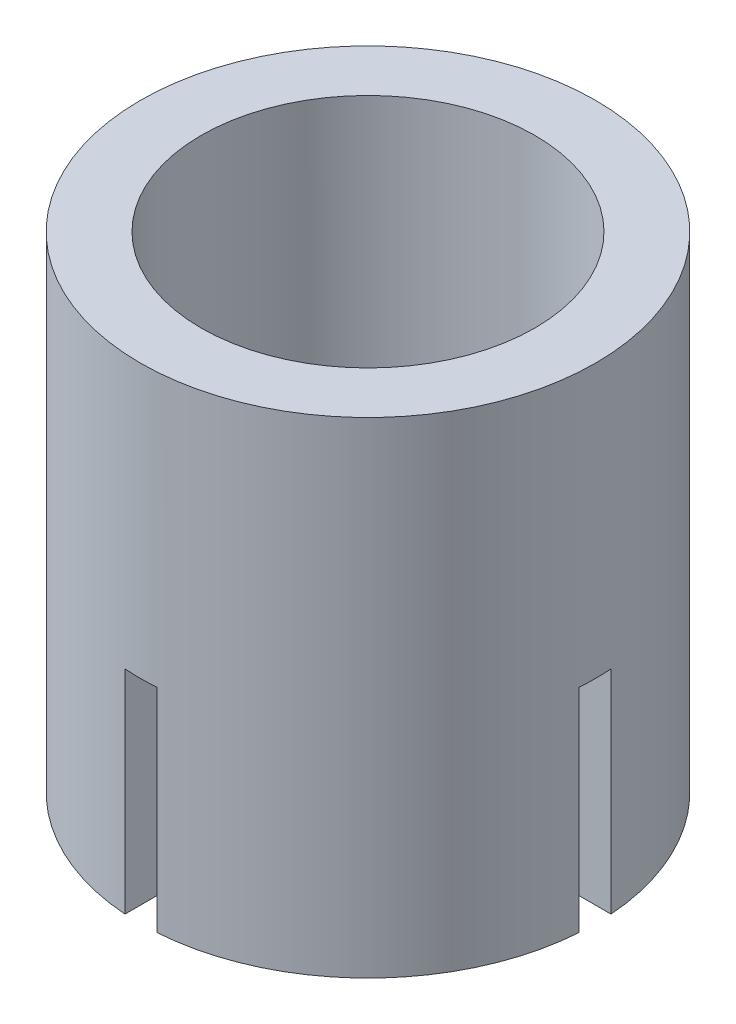
from build123d import *

# Parameters (mm, degrees)
SKETCH1_R           = 7.5
SKETCH1_R_2         = 3
BOSS_EXTRUDE1_DEPTH = 6
SKETCH2_R           = 7.5
SKETCH2_R_2         = 5.5
BOSS_EXTRUDE2_DEPTH = 10
CUT_EXTRUDE1_DEPTH  = 7


with BuildPart() as part:
    # Sketch1 → Boss-Extrude1 (new body)
    with BuildSketch(Plane(origin=(0, 0, 0), x_dir=(1, 0, 0), z_dir=(0, 1, 0))):
        with Locations(Location((0, 0, 0), (0, 0, 270))):
            Circle(SKETCH1_R)
        with Locations(Location((0, 0, 0), (0, 0, 270))):
            Circle(SKETCH1_R_2, mode=Mode.SUBTRACT)
    extrude(amount=BOSS_EXTRUDE1_DEPTH)

    # Sketch2 → Boss-Extrude2 (add)
    with BuildSketch(Plane(origin=(0, 6, 0), x_dir=(1, 0, 0), z_dir=(0, 1, 0))):
        with Locations(Location((0, 0, 0), (0, 0, 270))):
            Circle(SKETCH2_R)
        with Locations(Location((0, 0, 0), (0, 0, 270))):
            Circle(SKETCH2_R_2, mode=Mode.SUBTRACT)
    extrude(amount=BOSS_EXTRUDE2_DEPTH)

    # Sketch3 → Cut-Extrude1 (cut)
    with BuildSketch(Plane.XZ):
        with BuildLine():
            Line((-0.527362107, 10.532593193), (-0.527362107, 7.481436306))
            ThreePointArc((-0.527362107, 7.481436306), (0, 7.5), (0.527362107, 7.481436306))
            Line((0.527362107, 7.481436306), (0.527362107, 10.532593193))
            Line((0.527362107, 10.532593193), (-0.527362107, 10.532593193))
        make_face()
        with BuildLine():
            Line((-7.481436306, 0.527362107), (-10.459348456, 0.527362107))
            Line((-10.459348456, 0.527362107), (-10.459348456, -0.527362107))
            Line((-10.459348456, -0.527362107), (-7.481436306, -0.527362107))
            ThreePointArc((-7.481436306, -0.527362107), (-7.5, 0), (-7.481436306, 0.527362107))
        make_face()
        with BuildLine():
            ThreePointArc((0.527362107, 7.481436306), (0, 7.5), (-0.527362107, 7.481436306))
            Line((-0.527362107, 7.481436306), (-0.527362107, 2.953284478))
            ThreePointArc((-0.527362107, 2.953284478), (0, 3), (0.527362107, 2.953284478))
            Line((0.527362107, 2.953284478), (0.527362107, 7.481436306))
        make_face()
        with BuildLine():
            Line((-0.527362107, -2.953284478), (-0.527362107, -7.481436306))
            ThreePointArc((-0.527362107, -7.481436306), (0, -7.5), (0.527362107, -7.481436306))
            Line((0.527362107, -7.481436306), (0.527362107, -2.953284478))
            ThreePointArc((0.527362107, -2.953284478), (0, -3), (-0.527362107, -2.953284478))
        make_face()
        with BuildLine():
            Line((-2.953284478, 0.527362107), (-7.481436306, 0.527362107))
            ThreePointArc((-7.481436306, 0.527362107), (-7.5, 0), (-7.481436306, -0.527362107))
            Line((-7.481436306, -0.527362107), (-2.953284478, -0.527362107))
            ThreePointArc((-2.953284478, -0.527362107), (-3, 0), (-2.953284478, 0.527362107))
        make_face()
        with BuildLine():
            ThreePointArc((7.5, 0), (7.49535764, 0.263844368), (7.481436306, 0.527362107))
            Line((7.481436306, 0.527362107), (2.953284478, 0.527362107))
            ThreePointArc((2.953284478, 0.527362107), (2.988298298, 0.264713587), (3, 0))
            ThreePointArc((3, 0), (2.988298298, -0.264713587), (2.953284478, -0.527362107))
            Line((2.953284478, -0.527362107), (7.481436306, -0.527362107))
            ThreePointArc((7.481436306, -0.527362107), (7.49535764, -0.263844368), (7.5, 0))
        make_face()
    extrude(amount=-CUT_EXTRUDE1_DEPTH, mode=Mode.SUBTRACT)


solid = part.part
